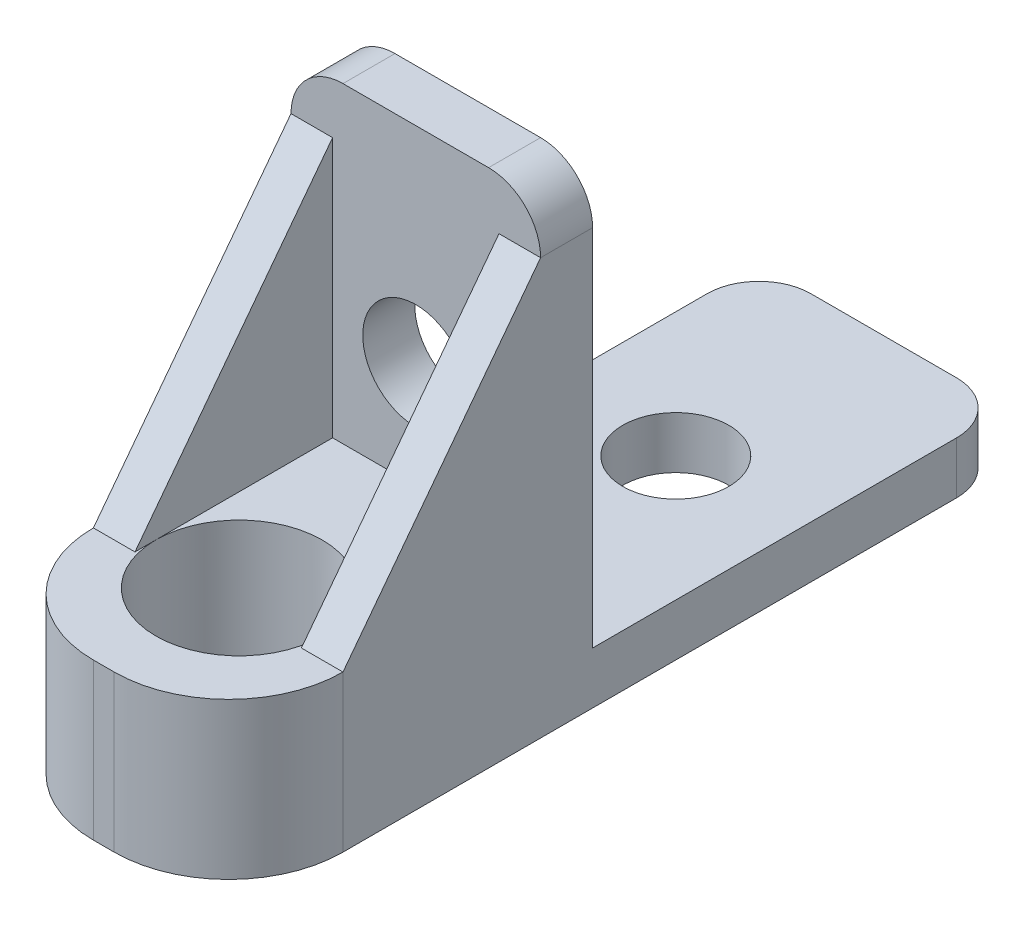
from build123d import *

# Parameters (mm, degrees)
SKETCH_1_R          = 2.55
SKETCH_1_R_2        = 4
EXTRUDE_1_DEPTH     = 2.5
SKETCH_2_W          = 12
SKETCH_2_H          = 2.5
EXTRUDE_2_DEPTH     = 20
SKETCH_3_R          = 2.55
CUT_EXTRUDE_1_DEPTH = 20
FILLET_1_R          = 2.5
EXTRUDE_3_DEPTH     = 5
EXTRUDE_4_DEPTH     = 2
EXTRUDE_5_DEPTH     = 2
SKETCH_7_R          = 4
CUT_EXTRUDE_2_DEPTH = 45.161634934


with BuildPart() as part:
    # Эскиз1 → Бобышка-Вытянуть1 (new body)
    with BuildSketch(Plane(origin=(0, 0, 0), x_dir=(1, 0, 0), z_dir=(0, 1, 0))):
        with BuildLine():
            Line((2.5, 0), (9.5, 0))
            ThreePointArc((9.5, 0), (11.267766953, -0.732233047), (12, -2.5))
            Line((12, -2.5), (12, -32))
            ThreePointArc((12, -32), (10.389087297, -35.889087297), (6.5, -37.5))
            Line((6.5, -37.5), (5.5, -37.5))
            ThreePointArc((5.5, -37.5), (1.610912703, -35.889087297), (0, -32))
            Line((0, -32), (0, -2.5))
            ThreePointArc((0, -2.5), (0.732233047, -0.732233047), (2.5, 0))
        make_face()
        with Locations(Location((6, -10, 0), (0, 0, 270))):
            Circle(SKETCH_1_R, mode=Mode.SUBTRACT)
        with Locations(Location((6, -31, 0), (0, 0, 270))):
            Circle(SKETCH_1_R_2, mode=Mode.SUBTRACT)
    extrude(amount=EXTRUDE_1_DEPTH)

    # Эскиз2 → Бобышка-Вытянуть2 (add)
    with BuildSketch(Plane(origin=(0, 2.5, 0), x_dir=(1, 0, 0), z_dir=(0, 1, 0))):
        with Locations((6, -21.25)):
            Rectangle(SKETCH_2_W, SKETCH_2_H)
    extrude(amount=EXTRUDE_2_DEPTH)

    # Эскиз3 → Вырез-Вытянуть1 (cut)
    with BuildSketch(Plane.XY.offset(22.5)):
        with Locations((6, 12.5)):
            Circle(SKETCH_3_R)
    extrude(amount=-CUT_EXTRUDE_1_DEPTH, mode=Mode.SUBTRACT)

    # Скругление1
    fillet_1_edges = [part.edges().sort_by_distance(p)[0] for p in [
        (0, 22.5, 21.25),
        (12, 22.5, 21.25),
    ]]
    fillet(fillet_1_edges, radius=FILLET_1_R)

    # Эскиз4 → Бобышка-Вытянуть3 (add)
    with BuildSketch(Plane(origin=(0, 2.5, 0), x_dir=(1, 0, 0), z_dir=(0, 1, 0))):
        with BuildLine():
            Line((12, -22.5), (0, -22.5))
            Line((0, -22.5), (0, -32))
            ThreePointArc((0, -32), (1.610912703, -35.889087297), (5.5, -37.5))
            Line((5.5, -37.5), (6.5, -37.5))
            ThreePointArc((6.5, -37.5), (10.389087297, -35.889087297), (12, -32))
            Line((12, -32), (12, -22.5))
        make_face()
    extrude(amount=EXTRUDE_3_DEPTH)

    # Эскиз5 → Бобышка-Вытянуть4 (add)
    with BuildSketch(Plane(origin=(12, 0, 0), x_dir=(0, 0, -1), z_dir=(1, 0, 0))):
        Polygon((-32, 7.5), (-22.5, 7.5), (-22.5, 20), align=None)
    extrude(amount=-EXTRUDE_4_DEPTH)

    # Эскиз6 → Бобышка-Вытянуть5 (add)
    with BuildSketch(Plane.ZY):
        Polygon((32, 7.5), (22.5, 20), (22.5, 7.5), align=None)
    extrude(amount=-EXTRUDE_5_DEPTH)

    # Эскиз7 → Вырез-Вытянуть2 (cut, through all)
    with BuildSketch(Plane.XZ.offset(-2.5)):
        with Locations(Location((6, 31, 0), (0, 0, 180))):
            Circle(SKETCH_7_R)
    extrude(amount=-CUT_EXTRUDE_2_DEPTH, mode=Mode.SUBTRACT)


solid = part.part
